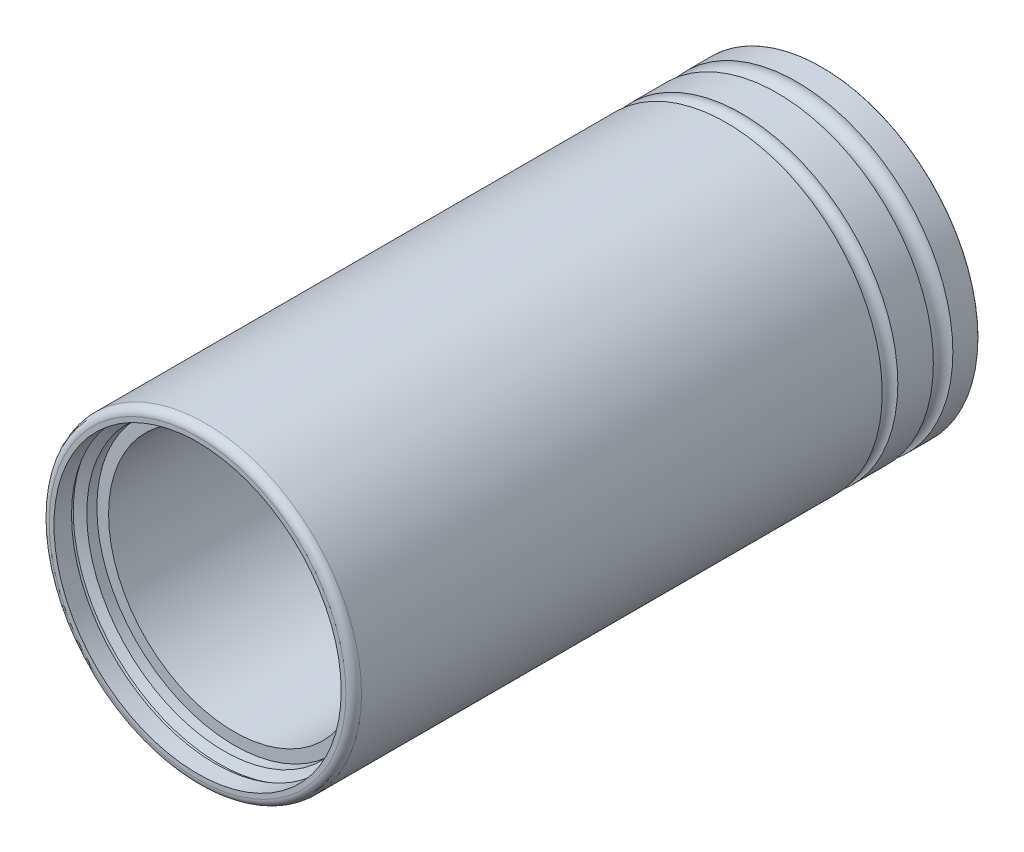
from build123d import *

# Parameters (mm, degrees)
SKETCH_1_R          = 20
EXTRUDE_1_DEPTH     = 80
FILLET_2_R          = 1
SKETCH_6_R          = 18.4
CUT_EXTRUDE_1_DEPTH = 2.6
FILLET_3_R          = 0.05
SKETCH_8_R          = 1.25
SKETCH_8_R_2        = 1
FILLET_12_R         = 0.4
FILLET_13_R         = 0.2
FILLET_14_R         = 0.2
FILLET_15_R         = 0.4
FILLET_16_R         = 0.2


with BuildPart() as part:
    # Эскиз1 → Бобышка-Вытянуть1 (new body)
    with BuildSketch(Plane.XY):
        Circle(SKETCH_1_R)
    extrude(amount=-EXTRUDE_1_DEPTH)

    # Эскиз4 → Вырез-Повернуть1 (revolve, cut)
    with BuildSketch(Plane(origin=(0, 0, 0), x_dir=(0, 0, -1), z_dir=(1, 0, 0)), mode=Mode.PRIVATE) as cut_revolve_1_sk:
        with BuildLine():
            Line((0, 0), (0, 17.6))
            Line((0, 17.6), (4.7, 17.6))
            Line((4.7, 17.6), (4.7, 16.1))
            Line((4.7, 16.1), (27, 16.1))
            Line((27, 16.1), (27, 17.1))
            Line((27, 17.1), (28.4, 17.1))
            Line((28.4, 17.1), (28.919615242, 16.2))
            Line((28.919615242, 16.2), (29.8, 16.2))
            Line((29.8, 16.2), (29.8, 17.7))
            Line((29.8, 17.7), (33.8, 17.7))
            Line((33.8, 17.7), (33.8, 16.2))
            Line((33.8, 16.2), (34.8, 16.2))
            Line((34.8, 16.2), (34.8, 17.9))
            Line((34.8, 17.9), (38, 17.9))
            Line((38, 17.9), (38, 16.2))
            Line((38, 16.2), (39, 16.2))
            Line((39, 16.2), (39, 17.7))
            Line((39, 17.7), (47.8, 17.7))
            Line((47.8, 17.7), (47.8, 16.2))
            Line((47.8, 16.2), (48.8, 16.2))
            Line((48.8, 16.2), (48.8, 17.9))
            Line((48.8, 17.9), (52, 17.9))
            Line((52, 17.9), (52, 16.2))
            Line((52, 16.2), (55, 16.2))
            Line((55, 16.2), (55, 6))
            Line((55, 6), (57, 6))
            Line((57, 6), (57, 9.5))
            Line((57, 9.5), (60.8, 9.5))
            ThreePointArc((60.8, 9.5), (61.4, 10.1), (62, 9.5))
            Line((62, 9.5), (63.5, 9.5))
            Line((63.5, 9.5), (63.5, 10.75))
            Line((63.5, 10.75), (75, 10.75))
            Line((75, 10.75), (75, 12.4))
            Line((75, 12.4), (78, 12.4))
            Line((78, 12.4), (78, 10.75))
            Line((78, 10.75), (80, 10.75))
            Line((80, 10.75), (80, 0))
            Line((80, 0), (0, 0))
        make_face()
    revolve(cut_revolve_1_sk.sketch.rotate(Axis((0, 0, -80), (0, 0, 1)), 90), axis=Axis((0, 0, -80), (0, 0, 1)), mode=Mode.SUBTRACT)

    # Эскиз5 → Вырез-Повернуть2 (revolve, cut)
    with BuildSketch(Plane(origin=(0, 0, 0), x_dir=(0, 0, -1), z_dir=(1, 0, 0)), mode=Mode.PRIVATE) as cut_revolve_2_sk:
        Polygon((3.408290377, 17.6), (1.791709623, 17.6), (2.6, 19), align=None)
    revolve(cut_revolve_2_sk.sketch.rotate(Axis((0, 0, 0), (0, 0, -1)), 270), axis=Axis((0, 0, 0), (0, 0, -1)), mode=Mode.SUBTRACT)

    # Скругление2
    fillet_2_edges = [part.edges().sort_by_distance(p)[0] for p in [
        (-20, 0, 0),
    ]]
    fillet(fillet_2_edges, radius=FILLET_2_R)

    # Эскиз6 → Вырез-Вытянуть1 (cut)
    with BuildSketch(Plane.XY):
        Circle(SKETCH_6_R)
    extrude(amount=-CUT_EXTRUDE_1_DEPTH, mode=Mode.SUBTRACT)

    # Скругление3
    fillet_3_edges = [part.edges().sort_by_distance(p)[0] for p in [
        (10.75, 0, -80),
        (-20, 0, -80),
        (6, 0, -57),
    ]]
    fillet(fillet_3_edges, radius=FILLET_3_R)

    # Эскиз7 → Повернуть1 (revolve)
    with BuildSketch(Plane(origin=(0, 0, 0), x_dir=(1, 0, 0), z_dir=(0, 1, 0)), mode=Mode.PRIVATE) as revolve_1_sk:
        with BuildLine():
            Line((-15.75, 80), (-13.25, 80))
            ThreePointArc((-13.25, 80), (-14.5, 81.25), (-15.75, 80))
        make_face()
    revolve(revolve_1_sk.sketch.rotate(Axis((0, 0, -88.958875933), (0, 0, 1)), 180), axis=Axis((0, 0, -88.958875933), (0, 0, 1)))

    # Эскиз8 → Вырез-Повернуть3 (revolve, cut)
    with BuildSketch(Plane(origin=(0, 0, 0), x_dir=(0, 0, -1), z_dir=(1, 0, 0)), mode=Mode.PRIVATE) as cut_revolve_3_sk:
        with Locations((75.5, 20)):
            Circle(SKETCH_8_R)
        with Locations((68.7, 20)):
            Circle(SKETCH_8_R_2)
    revolve(cut_revolve_3_sk.sketch.rotate(Axis((0, 0, 0), (0, 0, -1)), 90), axis=Axis((0, 0, 0), (0, 0, -1)), mode=Mode.SUBTRACT)

    # Скругление12
    fillet_12_edges = [part.edges().sort_by_distance(p)[0] for p in [
        (17.9, 0, -34.8),
        (17.9, 0, -38),
        (17.9, 0, -48.8),
        (17.9, 0, -52),
    ]]
    fillet(fillet_12_edges, radius=FILLET_12_R)

    # Скругление13
    fillet_13_edges = [part.edges().sort_by_distance(p)[0] for p in [
        (16.2, 0, -34.8),
        (16.2, 0, -38),
        (16.2, 0, -48.8),
        (16.2, 0, -52),
    ]]
    fillet(fillet_13_edges, radius=FILLET_13_R)

    # Скругление14
    fillet_14_edges = [part.edges().sort_by_distance(p)[0] for p in [
        (10.75, 0, -78),
        (10.75, 0, -75),
    ]]
    fillet(fillet_14_edges, radius=FILLET_14_R)

    # Скругление15
    fillet_15_edges = [part.edges().sort_by_distance(p)[0] for p in [
        (12.4, 0, -75),
        (12.4, 0, -78),
    ]]
    fillet(fillet_15_edges, radius=FILLET_15_R)

    # Скругление16
    fillet_16_edges = [part.edges().sort_by_distance(p)[0] for p in [
        (19, 0, -2.6),
    ]]
    fillet(fillet_16_edges, radius=FILLET_16_R)


solid = part.part
